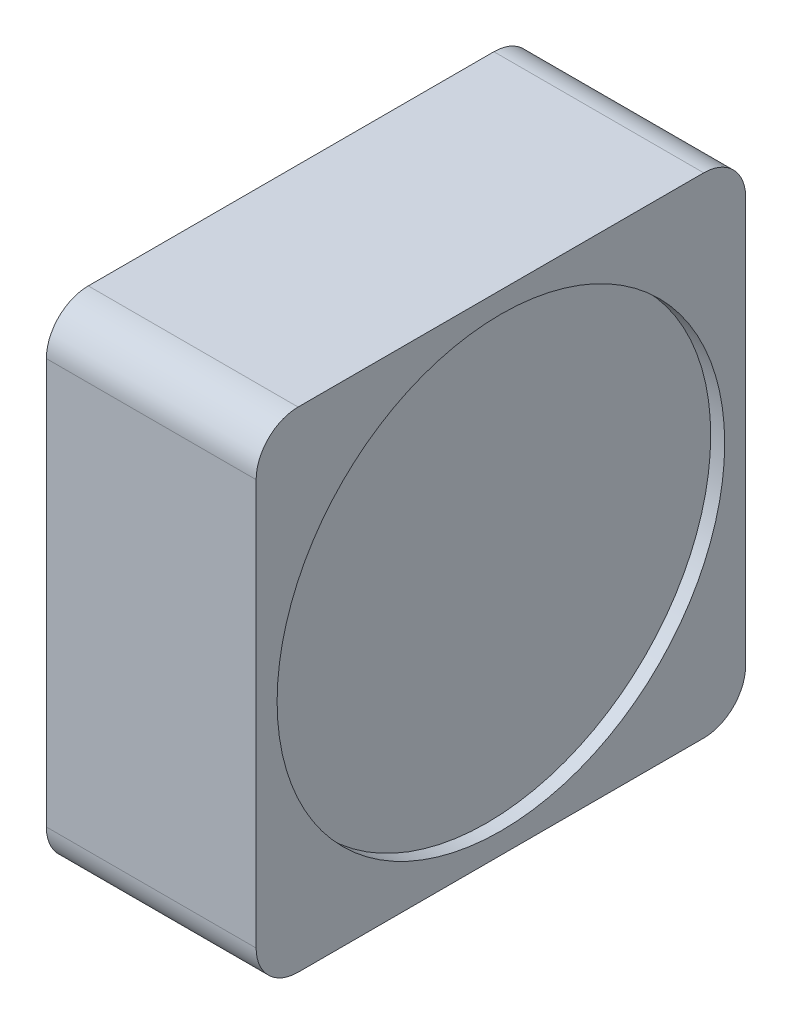
from build123d import *

# Parameters (mm, degrees)
IZIM1_W                     = 350
IZIM1_H                     = 350
Y_KSEKLIK_EKSTR_ZYON1_DEPTH = 150
IZIM2_R                     = 160
KES_EKSTR_ZYON1_DEPTH       = 10
RADYUS1_R                   = 30


with BuildPart() as part:
    # Çizim1 → Yükseklik-Ekstrüzyon1 (new body)
    with BuildSketch(Plane(origin=(0, 0, 0), x_dir=(0, 0, -1), z_dir=(1, 0, 0))):
        Rectangle(IZIM1_W, IZIM1_H)
    extrude(amount=Y_KSEKLIK_EKSTR_ZYON1_DEPTH)

    # Çizim2 → Kes-Ekstrüzyon1 (cut)
    with BuildSketch(Plane(origin=(150, 0, 0), x_dir=(0, 0, -1), z_dir=(1, 0, 0))):
        Circle(IZIM2_R)
    extrude(amount=-KES_EKSTR_ZYON1_DEPTH, mode=Mode.SUBTRACT)

    # Radyus1
    radyus1_edges = [part.edges().sort_by_distance(p)[0] for p in [
        (75, -175, -175),
        (75, -175, 175),
        (75, 175, 175),
        (75, 175, -175),
    ]]
    fillet(radyus1_edges, radius=RADYUS1_R)


solid = part.part
